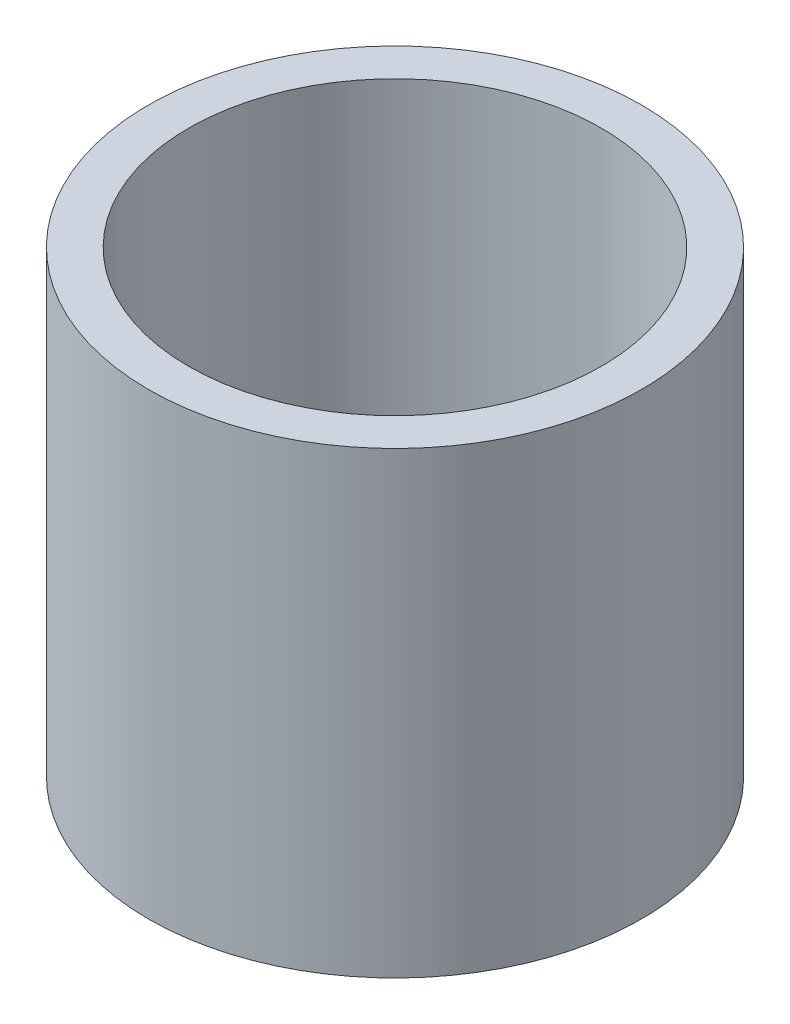
from build123d import *

# Parameters (mm, degrees)
SKETCH1_R            = 2.15
BOSS_EXTRUDE1_DEPTH  = 4
M3_CLEARANCE_HOLE1_D = 3.6


with BuildPart() as part:
    # Sketch1 → Boss-Extrude1 (new body)
    with BuildSketch(Plane(origin=(0, 0, 0), x_dir=(1, 0, 0), z_dir=(0, 1, 0))):
        with Locations(Location((0, 0, 0), (0, 0, 270))):
            Circle(SKETCH1_R)
    extrude(amount=BOSS_EXTRUDE1_DEPTH)

    # M3 Clearance Hole1 (through all)
    with Locations(Plane(origin=(0, 4, 0), x_dir=(1, 0, 0), z_dir=(0, 1, 0))):
        with Locations((0, 0)):
            Hole(M3_CLEARANCE_HOLE1_D / 2)


solid = part.part
